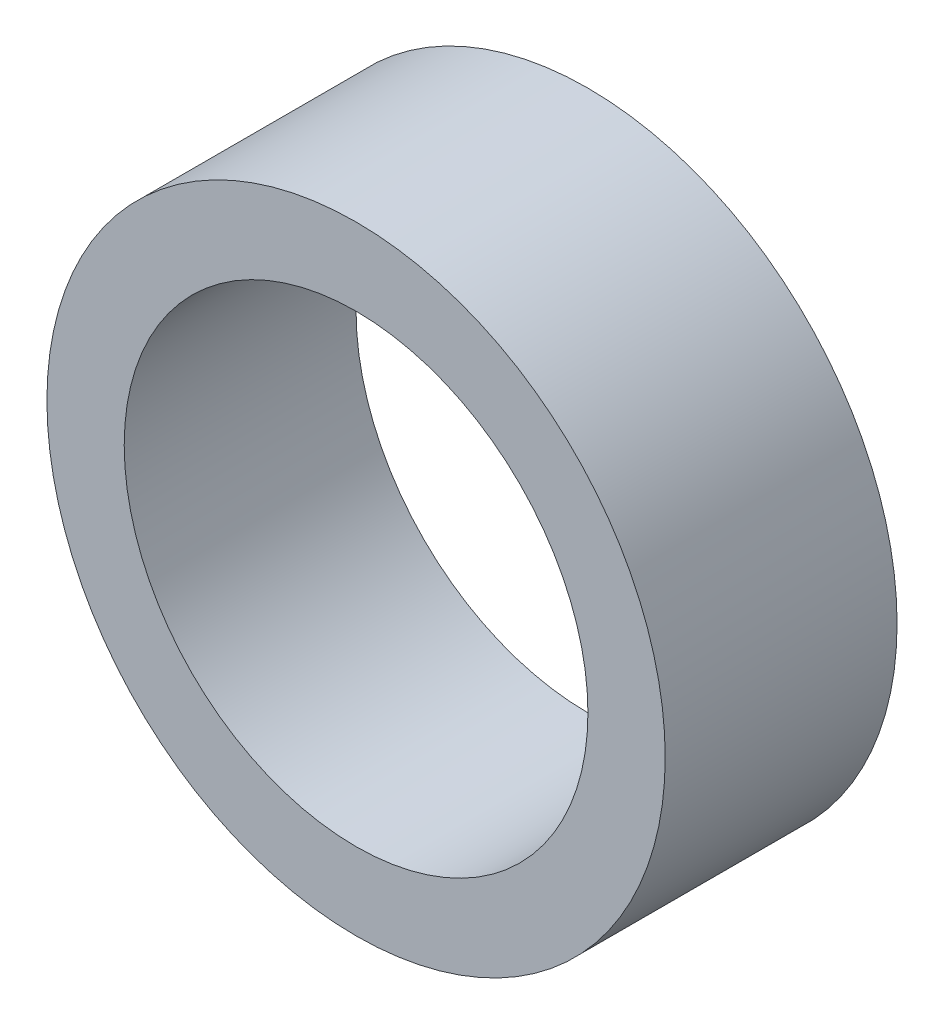
from build123d import *

# Parameters (mm, degrees)
SKETCH_1_R      = 4
SKETCH_1_R_2    = 3
EXTRUDE_1_DEPTH = 3


with BuildPart() as part:
    # 草图1 → 凸台-拉伸1 (new body)
    with BuildSketch(Plane.XY):
        Circle(SKETCH_1_R)
        Circle(SKETCH_1_R_2, mode=Mode.SUBTRACT)
    extrude(amount=EXTRUDE_1_DEPTH)


solid = part.part
